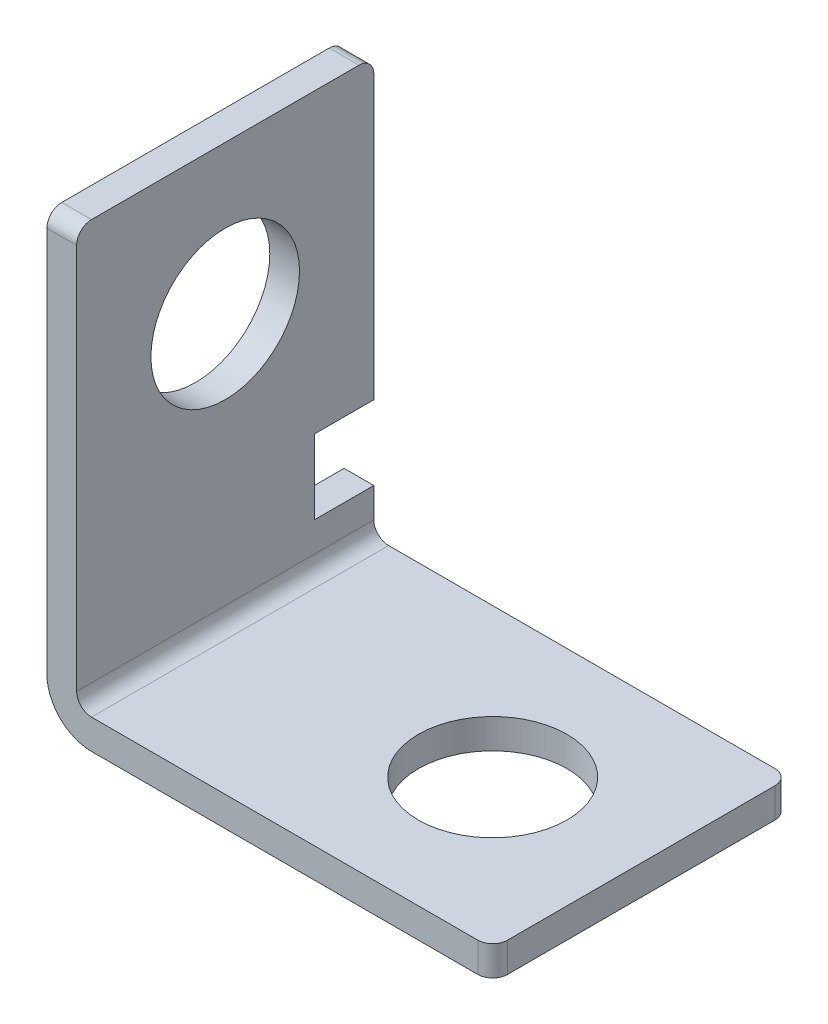
from build123d import *

# Parameters (mm, degrees)
BOSS_EXTRUDE1_DEPTH = 20
SKETCH2_R           = 5
CUT_EXTRUDE1_DEPTH  = 20
SKETCH3_R           = 5
SKETCH3_W           = 4
SKETCH3_H           = 5
CUT_EXTRUDE2_DEPTH  = 20
FILLET1_R           = 1
FILLET2_R           = 3


with BuildPart() as part:
    # Sketch1 → Boss-Extrude1 (new body)
    with BuildSketch(Plane.XY):
        Polygon((0, 0), (-30, 0), (-30, 30), (-28, 30), (-28, 2), (0, 2), align=None)
    extrude(amount=-BOSS_EXTRUDE1_DEPTH)

    # Sketch2 → Cut-Extrude1 (cut)
    with BuildSketch(Plane(origin=(0, 2, 0), x_dir=(1, 0, 0), z_dir=(0, 1, 0))):
        with Locations(Location((-10, 10, 0), (0, 0, 270))):
            Circle(SKETCH2_R)
    extrude(amount=-CUT_EXTRUDE1_DEPTH, mode=Mode.SUBTRACT)

    # Sketch3 → Cut-Extrude2 (cut)
    with BuildSketch(Plane(origin=(-28, 0, 0), x_dir=(0, 0, -1), z_dir=(1, 0, 0))):
        with Locations(Location((10, 20, 0), (0, 0, 90))):
            Circle(SKETCH3_R)
        with Locations((18, 7.5)):
            Rectangle(SKETCH3_W, SKETCH3_H)
    extrude(amount=-CUT_EXTRUDE2_DEPTH, mode=Mode.SUBTRACT)

    # Fillet1
    fillet1_edges = [part.edges().sort_by_distance(p)[0] for p in [
        (-28, 2, -10),
        (-29, 30, -20),
        (0, 1, -20),
        (-29, 30, 0),
        (0, 1, 0),
    ]]
    fillet(fillet1_edges, radius=FILLET1_R)

    # Fillet2
    fillet2_edges = [part.edges().sort_by_distance(p)[0] for p in [
        (-30, 0, -10),
    ]]
    fillet(fillet2_edges, radius=FILLET2_R)


solid = part.part
